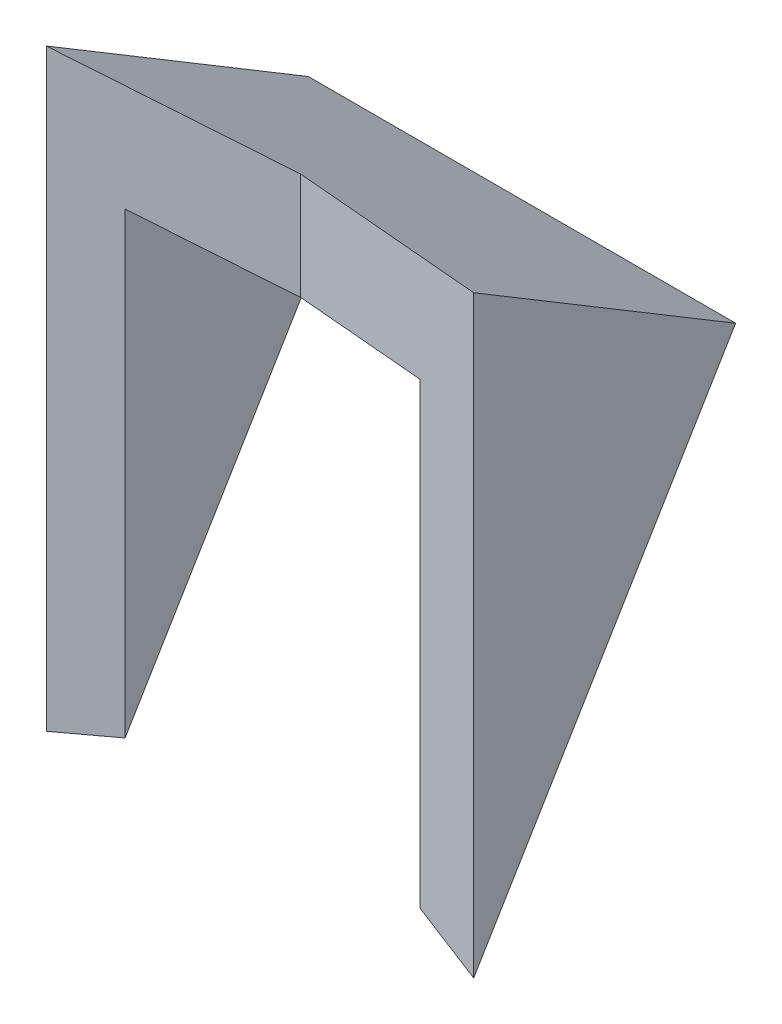
from build123d import *

# Parameters (mm, degrees)
EXTRUDE_1_DEPTH     = 42
CUT_EXTRUDE_3_DEPTH = 77.352761936
SKETCH_4_W          = 29
SKETCH_4_H          = 38.596109301
CUT_EXTRUDE_4_DEPTH = 42


with BuildPart() as part:
    # Эскиз1 → Бобышка-Вытянуть1 (new body)
    with BuildSketch(Plane(origin=(0, 0, 0), x_dir=(0, 0, -1), z_dir=(1, 0, 0))):
        Polygon((0, 0), (-25.751903746, 15.473304826), (-25.751903746, -42.858365035), align=None)
    extrude(amount=EXTRUDE_1_DEPTH)

    # Эскиз3 → Вырез-Вытянуть3 (cut, through all)
    with BuildSketch(Plane(origin=(0, 15.473304826, 0), x_dir=(1, 0, 0), z_dir=(0, 1, 0))):
        Polygon((0, -25.751903746), (21, -21.751903746), (42, -25.751903746), align=None)
    extrude(amount=-CUT_EXTRUDE_3_DEPTH, mode=Mode.SUBTRACT)

    # Эскиз4 → Вырез-Вытянуть4 (cut)
    with BuildSketch(Plane(origin=(0, 0, 0), x_dir=(-1, 0, 0), z_dir=(0, -0.5150380749100486, -0.8571673007021157))):
        with Locations((-21, -28.298054651)):
            Rectangle(SKETCH_4_W, SKETCH_4_H)
    extrude(amount=-CUT_EXTRUDE_4_DEPTH, mode=Mode.SUBTRACT)


solid = part.part
